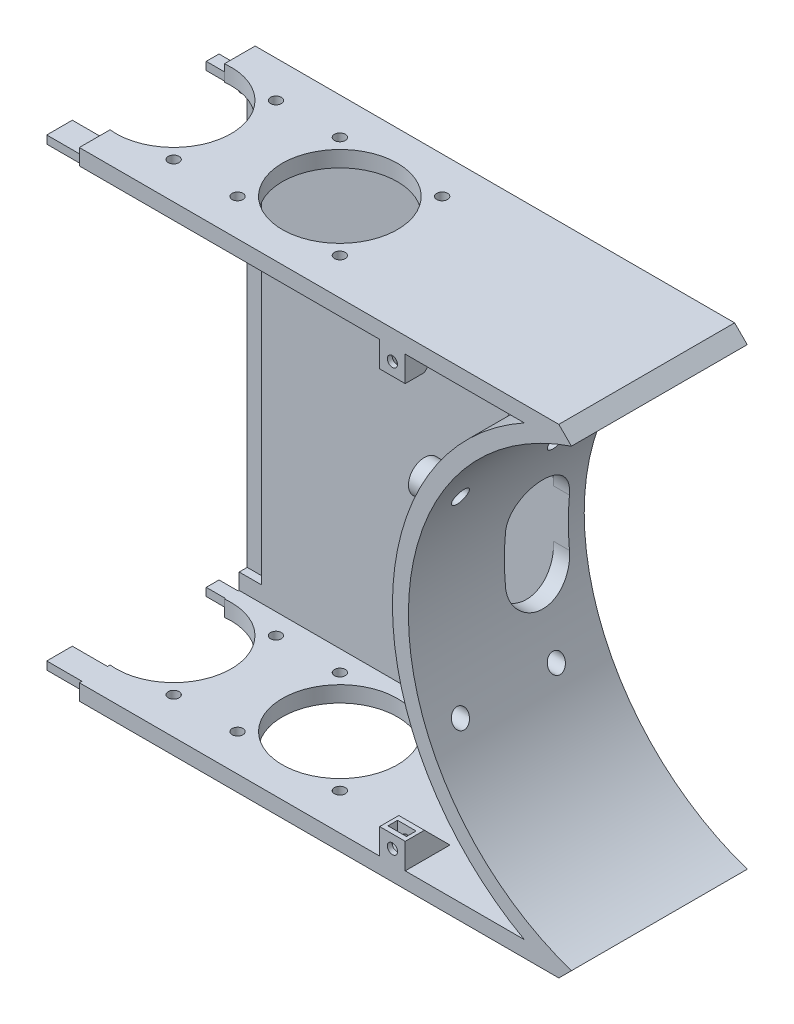
from build123d import *

# Parameters (mm, degrees)
SALIENTE_EXTRUIR1_DEPTH      = 55
CORTAR_EXTRUIR1_DEPTH        = 50
CORTAR_EXTRUIR2_DEPTH        = 82
CROQUIS4_R                   = 2.6
CORTAR_EXTRUIR3_DEPTH        = 82
SALIENTE_EXTRUIR2_REACH      = 266.813
SALIENTE_EXTRUIR2_END_RADIUS = 80
CROQUIS5_R                   = 5
CROQUIS5_R_2                 = 2.6
CROQUIS6_R                   = 1.6
CORTAR_EXTRUIR4_DEPTH        = 82
CROQUIS7_W                   = 11.2
CROQUIS7_H                   = 9.5
CORTAR_EXTRUIR5_DEPTH        = 13
CROQUIS8_W                   = 11.2
CROQUIS8_H                   = 12.4
CORTAR_EXTRUIR6_DEPTH        = 13
SALIENTE_EXTRUIR3_START      = 14.8
CROQUIS9_R                   = 4
CROQUIS9_R_2                 = 1.6
SALIENTE_EXTRUIR3_DEPTH      = 14.8
CROQUIS10_R                  = 1.7
CROQUIS10_R_2                = 18
CORTAR_EXTRUIR7_DEPTH        = 14.8
CORTAR_EXTRUIR8_DEPTH        = 1.5
CORTAR_EXTRUIR8_DEPTH_BACK   = 1.5
SALIENTE_EXTRUIR4_DEPTH      = 4
SALIENTE_EXTRUIR4_DEPTH_BACK = 4
SALIENTE_EXTRUIR5_DEPTH      = 4
CROQUIS13_R                  = 1.6
CORTAR_EXTRUIR9_DEPTH        = 14
CORTAR_EXTRUIR10_DEPTH       = 1.5
CORTAR_EXTRUIR10_DEPTH_BACK  = 1.5
CROQUIS18_W                  = 160
CROQUIS18_H                  = 200
CORTAR_EXTRUIR11_DEPTH       = 122
CROQUIS19_W                  = 22
CROQUIS19_H                  = 8
CROQUIS19_W_2                = 12
CROQUIS19_H_2                = 4
SALIENTE_EXTRUIR6_DEPTH      = 2.5
CROQUIS21_W                  = 14
CROQUIS21_H                  = 130
CORTAR_EXTRUIR12_DEPTH       = 2.5


with BuildPart() as part:
    # Croquis1 → Saliente-Extruir1 (new body)
    with BuildSketch(Plane.XY):
        with BuildLine():
            Line((-327.943684306, 75), (-327.943684306, -75))
            Line((-327.943684306, -75), (-27.943684306, -75))
            Line((-27.943684306, -75), (-24, -71.056315694))
            ThreePointArc((-24, -71.056315694), (-75, 0), (-24, 71.056315694))
            Line((-24, 71.056315694), (-27.943684306, 75))
            Line((-27.943684306, 75), (-327.943684306, 75))
        make_face()
    extrude(amount=SALIENTE_EXTRUIR1_DEPTH)

    # Croquis2 → Cortar-Extruir1 (cut)
    with BuildSketch(Plane.XY.offset(55)):
        with BuildLine():
            Line((-38.729833462, 70), (-322.943684306, 70))
            Line((-322.943684306, 70), (-322.943684306, -70))
            Line((-322.943684306, -70), (-38.729833462, -70))
            ThreePointArc((-38.729833462, -70), (-80, 0), (-38.729833462, 70))
        make_face()
    extrude(amount=-CORTAR_EXTRUIR1_DEPTH, mode=Mode.SUBTRACT)

    # Croquis3 → Cortar-Extruir2 (cut)
    with BuildSketch(Plane(origin=(0, 0, 0), x_dir=(0, 0, -1), z_dir=(1, 0, 0))):
        with BuildLine():
            Line((-5, 7.5), (-5, -7.5))
            ThreePointArc((-5, -7.5), (-15, -17.5), (-25, -7.5))
            Line((-25, -7.5), (-25, 7.5))
            ThreePointArc((-25, 7.5), (-15, 17.5), (-5, 7.5))
        make_face()
    extrude(amount=-CORTAR_EXTRUIR2_DEPTH, mode=Mode.SUBTRACT)

    # Croquis4 → Cortar-Extruir3 (cut)
    with BuildSketch(Plane(origin=(0, 0, 0), x_dir=(0, 0, -1), z_dir=(1, 0, 0))):
        with Locations((-45, -30)):
            Circle(CROQUIS4_R)
        with Locations((-15, -30)):
            Circle(CROQUIS4_R)
        with Locations((-15, 30)):
            Circle(CROQUIS4_R)
        with Locations((-45, 30)):
            Circle(CROQUIS4_R)
    extrude(amount=-CORTAR_EXTRUIR3_DEPTH, mode=Mode.SUBTRACT)

    # Saliente-Extruir2: up to this cylinder (the profile starts outside it)
    saliente_extruir2_end = Plane(origin=(0, 0, 25.141421), z_dir=(0, 0, 1)) * Cylinder(SALIENTE_EXTRUIR2_END_RADIUS, 724.626, mode=Mode.PRIVATE)
    # Croquis5 → Saliente-Extruir2 (add, up to the surface)
    with BuildSketch(Plane.ZY.offset(80), mode=Mode.PRIVATE) as saliente_extruir2_sk1:
        with Locations((45, 30)):
            Circle(CROQUIS5_R)
        with Locations(Location((45, 30, 0), (0, 0, 180))):
            Circle(CROQUIS5_R_2, mode=Mode.SUBTRACT)
    saliente_extruir2_tool1 = extrude(saliente_extruir2_sk1.sketch, amount=-SALIENTE_EXTRUIR2_REACH, mode=Mode.PRIVATE) - saliente_extruir2_end
    add(saliente_extruir2_tool1.solids().sort_by_distance((-80, 30, 40.141421))[0])
    # Croquis5 → Saliente-Extruir2 (add, up to the surface)
    with BuildSketch(Plane.ZY.offset(80), mode=Mode.PRIVATE) as saliente_extruir2_sk2:
        with Locations((15, 30)):
            Circle(CROQUIS5_R)
        with Locations(Location((15, 30, 0), (0, 0, 180))):
            Circle(CROQUIS5_R_2, mode=Mode.SUBTRACT)
    saliente_extruir2_tool2 = extrude(saliente_extruir2_sk2.sketch, amount=-SALIENTE_EXTRUIR2_REACH, mode=Mode.PRIVATE) - saliente_extruir2_end
    add(saliente_extruir2_tool2.solids().sort_by_distance((-80, 30, 10.141421))[0])
    # Croquis5 → Saliente-Extruir2 (add, up to the surface)
    with BuildSketch(Plane.ZY.offset(80), mode=Mode.PRIVATE) as saliente_extruir2_sk3:
        with Locations((45, -30)):
            Circle(CROQUIS5_R)
        with Locations(Location((45, -30, 0), (0, 0, 180))):
            Circle(CROQUIS5_R_2, mode=Mode.SUBTRACT)
    saliente_extruir2_tool3 = extrude(saliente_extruir2_sk3.sketch, amount=-SALIENTE_EXTRUIR2_REACH, mode=Mode.PRIVATE) - saliente_extruir2_end
    add(saliente_extruir2_tool3.solids().sort_by_distance((-80, -30, 40.141421))[0])
    # Croquis5 → Saliente-Extruir2 (add, up to the surface)
    with BuildSketch(Plane.ZY.offset(80), mode=Mode.PRIVATE) as saliente_extruir2_sk4:
        with Locations((15, -30)):
            Circle(CROQUIS5_R)
        with Locations(Location((15, -30, 0), (0, 0, 180))):
            Circle(CROQUIS5_R_2, mode=Mode.SUBTRACT)
    saliente_extruir2_tool4 = extrude(saliente_extruir2_sk4.sketch, amount=-SALIENTE_EXTRUIR2_REACH, mode=Mode.PRIVATE) - saliente_extruir2_end
    add(saliente_extruir2_tool4.solids().sort_by_distance((-80, -30, 10.141421))[0])

    # Croquis6 → Cortar-Extruir4 (cut)
    with BuildSketch(Plane.XY.offset(5)):
        with Locations((-302.943684306, 44)):
            Circle(CROQUIS6_R)
        with Locations((-317.943684306, -44)):
            Circle(CROQUIS6_R)
        with Locations((-190.943684306, 43)):
            Circle(CROQUIS6_R)
        with Locations((-102.943684306, 43)):
            Circle(CROQUIS6_R)
        with Locations((-102.943684306, -43)):
            Circle(CROQUIS6_R)
    extrude(amount=-CORTAR_EXTRUIR4_DEPTH, mode=Mode.SUBTRACT)

    # Croquis7 → Cortar-Extruir5 (cut)
    with BuildSketch(Plane.ZY.offset(327.943684306)):
        with Locations((26.9, 39.05)):
            Rectangle(CROQUIS7_W, CROQUIS7_H)
    extrude(amount=-CORTAR_EXTRUIR5_DEPTH, mode=Mode.SUBTRACT)

    # Croquis8 → Cortar-Extruir6 (cut)
    with BuildSketch(Plane.ZY.offset(327.943684306)):
        with Locations((14.1, -1.8)):
            Rectangle(CROQUIS8_W, CROQUIS8_H)
    extrude(amount=-CORTAR_EXTRUIR6_DEPTH, mode=Mode.SUBTRACT)

    # Croquis9 → Saliente-Extruir3 (add)
    # profile 1 of 5: a face of its own
    with BuildSketch(Plane.XY.offset(5).offset(SALIENTE_EXTRUIR3_START)):
        with Locations((-302.943684306, 44)):
            Circle(CROQUIS9_R)
        with Locations((-302.943684306, 44)):
            Circle(CROQUIS9_R_2, mode=Mode.SUBTRACT)
    # profile 2 of 5: a face of its own
    with BuildSketch(Plane.XY.offset(5).offset(SALIENTE_EXTRUIR3_START)):
        with Locations((-317.943684306, -44)):
            Circle(CROQUIS9_R)
        with Locations((-317.943684306, -44)):
            Circle(CROQUIS9_R_2, mode=Mode.SUBTRACT)
    # profile 3 of 5: a face of its own
    with BuildSketch(Plane.XY.offset(5).offset(SALIENTE_EXTRUIR3_START)):
        with Locations((-190.943684306, 43)):
            Circle(CROQUIS9_R)
        with Locations((-190.943684306, 43)):
            Circle(CROQUIS9_R_2, mode=Mode.SUBTRACT)
    # profile 4 of 5: a face of its own
    with BuildSketch(Plane.XY.offset(5).offset(SALIENTE_EXTRUIR3_START)):
        with Locations((-102.943684306, 43)):
            Circle(CROQUIS9_R)
        with Locations((-102.943684306, 43)):
            Circle(CROQUIS9_R_2, mode=Mode.SUBTRACT)
    # profile 5 of 5: a face of its own
    with BuildSketch(Plane.XY.offset(5).offset(SALIENTE_EXTRUIR3_START)):
        with Locations((-102.943684306, -43)):
            Circle(CROQUIS9_R)
        with Locations((-102.943684306, -43)):
            Circle(CROQUIS9_R_2, mode=Mode.SUBTRACT)
    extrude(amount=-SALIENTE_EXTRUIR3_DEPTH)

    # Croquis10 → Cortar-Extruir7 (cut)
    with BuildSketch(Plane.XZ.offset(75)):
        with Locations(Location((-191.943684306, 43.5, 0), (0, 0, 270))):
            Circle(CROQUIS10_R)
        with Locations(Location((-159.943684306, 43.5, 0), (0, 0, 270))):
            Circle(CROQUIS10_R)
        with Locations(Location((-191.943684306, 11.5, 0), (0, 0, 270))):
            Circle(CROQUIS10_R)
        with Locations(Location((-159.943684306, 11.5, 0), (0, 0, 270))):
            Circle(CROQUIS10_R)
        with Locations(Location((-139.943684306, 43.5, 0), (0, 0, 270))):
            Circle(CROQUIS10_R)
        with Locations(Location((-107.943684306, 43.5, 0), (0, 0, 270))):
            Circle(CROQUIS10_R)
        with Locations(Location((-139.943684306, 11.5, 0), (0, 0, 270))):
            Circle(CROQUIS10_R)
        with Locations(Location((-107.943684306, 11.5, 0), (0, 0, 270))):
            Circle(CROQUIS10_R)
        with Locations(Location((-175.943684306, 27.5, 0), (0, 0, 270))):
            Circle(CROQUIS10_R_2)
        with Locations(Location((-123.943684306, 27.5, 0), (0, 0, 270))):
            Circle(CROQUIS10_R_2)
    cortar_extruir7 = extrude(amount=-CORTAR_EXTRUIR7_DEPTH, mode=Mode.SUBTRACT)

    # Simetría1: Cortar-Extruir7 across plane
    add(cortar_extruir7.mirror(Plane.ZX), mode=Mode.SUBTRACT)

    # Croquis11 → Cortar-Extruir8 (cut, two sides: drawn at the far end of the back side and taken through both)
    with BuildSketch(Plane.XY.offset(13).offset(-CORTAR_EXTRUIR8_DEPTH_BACK)):
        Polygon((-301.268684306, 46.901185103), (-296.596208082, 46.901185103), (-296.596208082, 41.098814897), (-301.268684306, 41.098814897), (-304.618684306, 41.098814897), (-306.293684306, 44), (-304.618684306, 46.901185103), align=None)
        Polygon((-316.268684306, -41.098814897), (-319.618684306, -41.098814897), (-321.293684306, -44), (-319.618684306, -46.901185103), (-316.268684306, -46.901185103), (-310.721620957, -46.901185103), (-310.721620957, -41.098814897), align=None)
        Polygon((-187.593684306, 43), (-189.268684306, 45.901185103), (-192.618684306, 45.901185103), (-196.683445183, 45.901185103), (-196.683445183, 40.098814897), (-192.618684306, 40.098814897), (-189.268684306, 40.098814897), align=None)
        Polygon((-99.593684306, 43), (-101.268684306, 45.901185103), (-104.618684306, 45.901185103), (-110.770583293, 45.901185103), (-110.770583293, 40.098814897), (-104.618684306, 40.098814897), (-101.268684306, 40.098814897), align=None)
        Polygon((-99.593684306, -43), (-101.268684306, -40.098814897), (-104.618684306, -40.098814897), (-109.047231964, -40.098814897), (-109.167846689, -45.901185103), (-104.618684306, -45.901185103), (-101.268684306, -45.901185103), align=None)
    extrude(amount=CORTAR_EXTRUIR8_DEPTH + CORTAR_EXTRUIR8_DEPTH_BACK, mode=Mode.SUBTRACT)

    # Croquis12 → Saliente-Extruir4 (add, two sides: drawn at the far end of the back side and taken through both)
    with BuildSketch(Plane(origin=(0, 0, 0), x_dir=(1, 0, 0), z_dir=(0, 1, 0)).offset(-SALIENTE_EXTRUIR4_DEPTH_BACK)):
        Polygon((-322.943684306, -41), (-322.943684306, -55), (-314.943684306, -55), (-314.943684306, -49), align=None)
    extrude(amount=SALIENTE_EXTRUIR4_DEPTH + SALIENTE_EXTRUIR4_DEPTH_BACK)

    # Croquis14 → Saliente-Extruir5 (add, symmetric)
    with BuildSketch(Plane.ZY.offset(80)):
        Polygon((55, 70), (55, 62), (49, 62), (41, 70), align=None)
        Polygon((55, -70), (55, -62), (49, -62), (41, -70), align=None)
    saliente_extruir5 = extrude(amount=SALIENTE_EXTRUIR5_DEPTH, both=True)

    # Croquis13 → Cortar-Extruir9 (cut)
    with BuildSketch(Plane.XY.offset(55)):
        with Locations((-318.943684306, 0)):
            Circle(CROQUIS13_R)
        with Locations((-80, -66)):
            Circle(CROQUIS13_R)
        with Locations((-80, 66)):
            Circle(CROQUIS13_R)
    cortar_extruir9 = extrude(amount=-CORTAR_EXTRUIR9_DEPTH, mode=Mode.SUBTRACT)

    # Simetría2: Saliente-Extruir5, Cortar-Extruir9 across plane
    add(saliente_extruir5.mirror(Plane.ZY.offset(160)))
    add(cortar_extruir9.mirror(Plane.ZY.offset(160)), mode=Mode.SUBTRACT)

    # Croquis17 → Cortar-Extruir10 (cut, two sides: drawn at the far end of the back side and taken through both)
    with BuildSketch(Plane.XY.offset(52).offset(-CORTAR_EXTRUIR10_DEPTH_BACK)):
        Polygon((-317.268684306, 2.901185103), (-320.618684306, 2.901185103), (-322.293684306, 0), (-320.618684306, -2.901185103), (-317.268684306, -2.901185103), (-310.618684306, -2.901185103), (-310.618684306, 2.901185103), align=None)
        Polygon((-242.901185103, -64.325), (-242.901185103, -67.675), (-240, -69.35), (-237.098814897, -67.675), (-237.098814897, -64.325), (-237.098814897, -57.675), (-242.901185103, -57.675), align=None)
        Polygon((-82.901185103, -64.325), (-82.901185103, -67.675), (-80, -69.35), (-77.098814897, -67.675), (-77.098814897, -64.325), (-77.098814897, -57.675), (-82.901185103, -57.675), align=None)
        Polygon((-77.098814897, 64.325), (-77.098814897, 67.675), (-80, 69.35), (-82.901185103, 67.675), (-82.901185103, 64.325), (-82.901185103, 57.675), (-76.887318252, 57.675), align=None)
        Polygon((-237.098814897, 64.325), (-237.098814897, 67.675), (-240, 69.35), (-242.901185103, 67.675), (-242.901185103, 64.325), (-242.901185103, 57.675), (-237.098814897, 57.675), align=None)
    extrude(amount=CORTAR_EXTRUIR10_DEPTH + CORTAR_EXTRUIR10_DEPTH_BACK, mode=Mode.SUBTRACT)

    # Croquis18 → Cortar-Extruir11 (cut)
    with BuildSketch(Plane.XY):
        with Locations((-257.943684306, 0)):
            Rectangle(CROQUIS18_W, CROQUIS18_H)
    extrude(amount=CORTAR_EXTRUIR11_DEPTH, mode=Mode.SUBTRACT)

    # Croquis19 → Saliente-Extruir6 (add)
    with BuildSketch(Plane(origin=(0, -70, 0), x_dir=(1, 0, 0), z_dir=(0, 1, 0))):
        with Locations((-177.943684306, -50.19427191)):
            Rectangle(CROQUIS19_W, CROQUIS19_H)
        with Locations((-177.943684306, -7.30572809)):
            Rectangle(CROQUIS19_W_2, CROQUIS19_H_2)
    saliente_extruir6 = extrude(amount=-SALIENTE_EXTRUIR6_DEPTH)

    # Simetría3: Saliente-Extruir6 across plane
    add(saliente_extruir6.mirror(Plane.ZX))

    # Croquis21 → Cortar-Extruir12 (cut)
    with BuildSketch(Plane.XY.offset(5)):
        with Locations((-177.943684306, 0)):
            Rectangle(CROQUIS21_W, CROQUIS21_H)
    extrude(amount=-CORTAR_EXTRUIR12_DEPTH, mode=Mode.SUBTRACT)


solid = part.part
